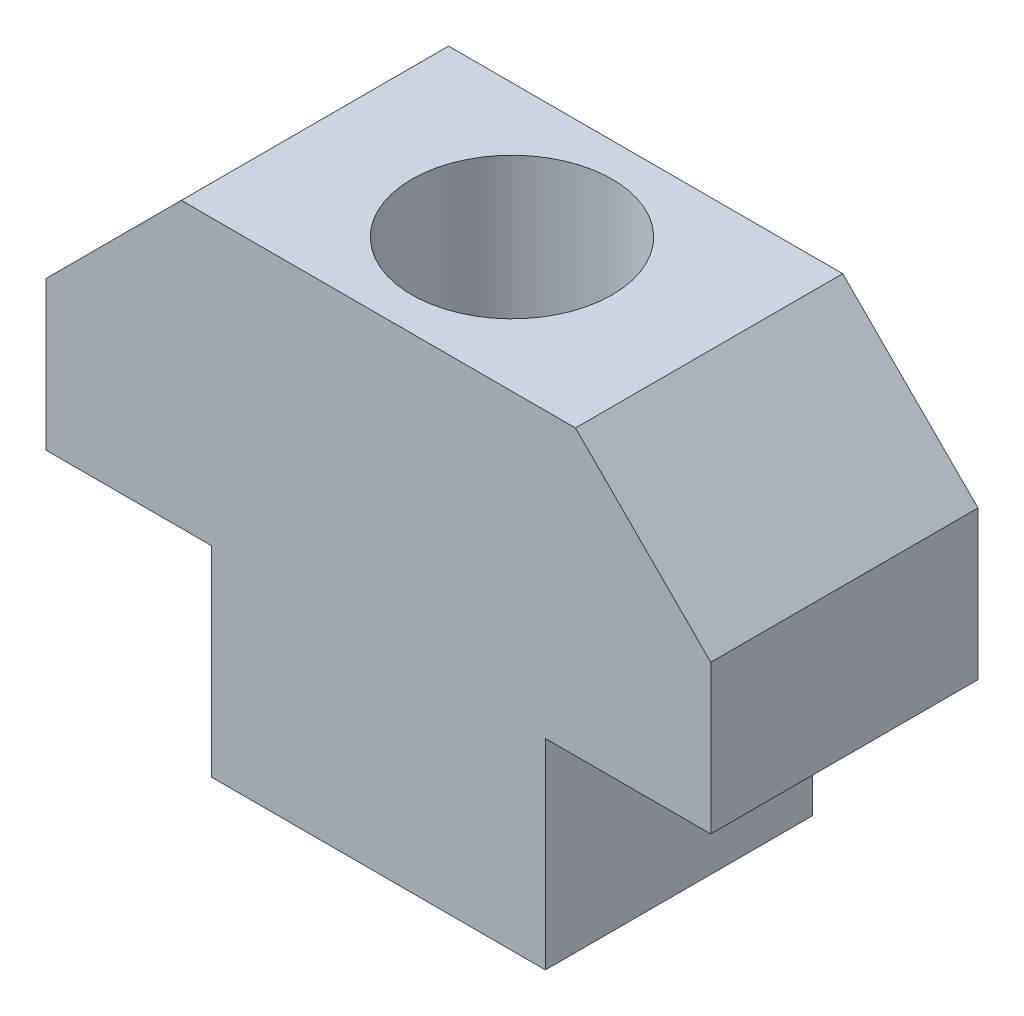
from build123d import *

# Parameters (mm, degrees)
EXTRUDE1_DEPTH     = 4
CUT_EXTRUDE1_REACH = 20.035
SKETCH2_R          = 3


with BuildPart() as part:
    # Sketch1 → Extrude1 (new, symmetric)
    with BuildSketch(Plane.XY):
        Polygon((-5, 0), (5, 0), (5, 6), (9.95, 6), (9.95, 10.45), (5.9, 14.5), (-5.9, 14.5), (-9.95, 10.45), (-9.95, 6), (-5, 6), align=None)
    extrude(amount=EXTRUDE1_DEPTH, both=True)

    # Sketch2 → Cut-Extrude1 (cut, up to next)
    with BuildSketch(Plane(origin=(0, 0, 0), x_dir=(1, 0, 0), z_dir=(0, 1, 0)), mode=Mode.PRIVATE) as cut_extrude1_sk1:
        Circle(SKETCH2_R)
    cut_extrude1_tool1 = extrude(cut_extrude1_sk1.sketch, amount=CUT_EXTRUDE1_REACH, mode=Mode.PRIVATE) & part.part
    add(cut_extrude1_tool1.solids().sort_by_distance((0, 0, 0))[0], mode=Mode.SUBTRACT)


solid = part.part
